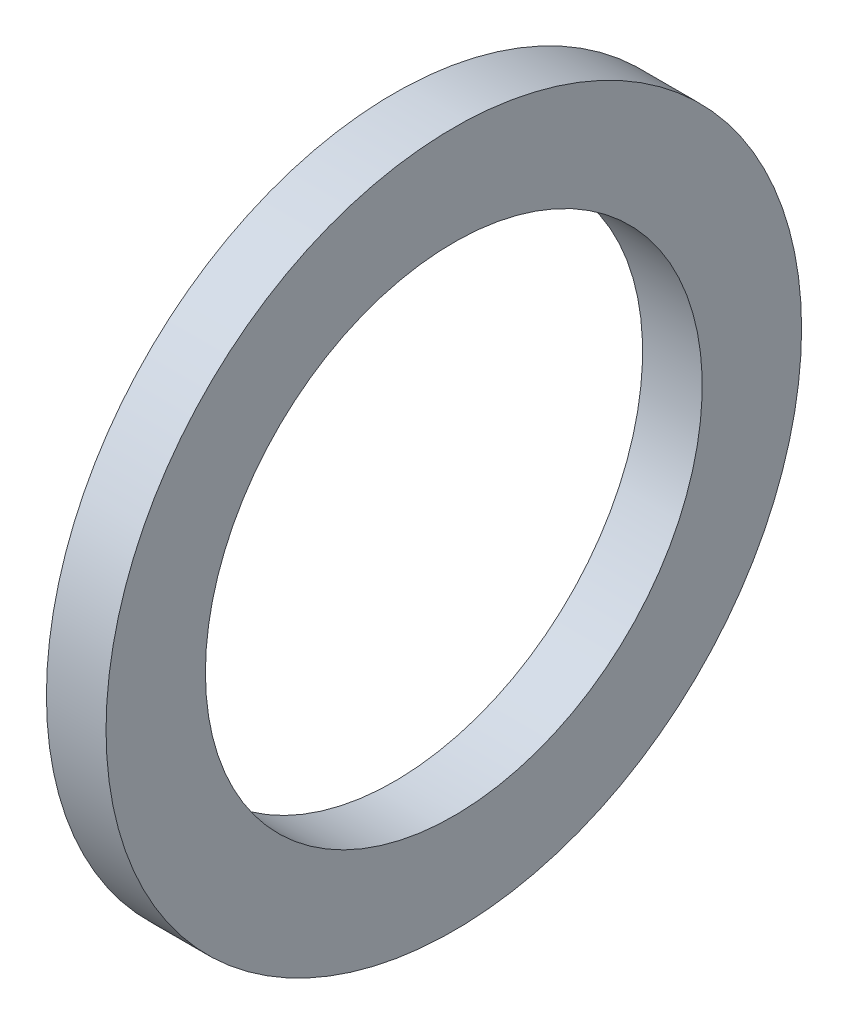
from build123d import *

# Parameters (mm, degrees)
SKETCH1_R           = 4.445
SKETCH1_R_2         = 3.175
BOSS_EXTRUDE1_DEPTH = 0.762


with BuildPart() as part:
    # Sketch1 → Boss-Extrude1 (new body)
    with BuildSketch(Plane(origin=(0, 0, 0), x_dir=(0, 0, -1), z_dir=(1, 0, 0))):
        with Locations(Location((0, 0, 0), (0, 0, 180))):
            Circle(SKETCH1_R)
        with Locations(Location((0, 0, 0), (0, 0, 180))):
            Circle(SKETCH1_R_2, mode=Mode.SUBTRACT)
    extrude(amount=BOSS_EXTRUDE1_DEPTH)


solid = part.part
